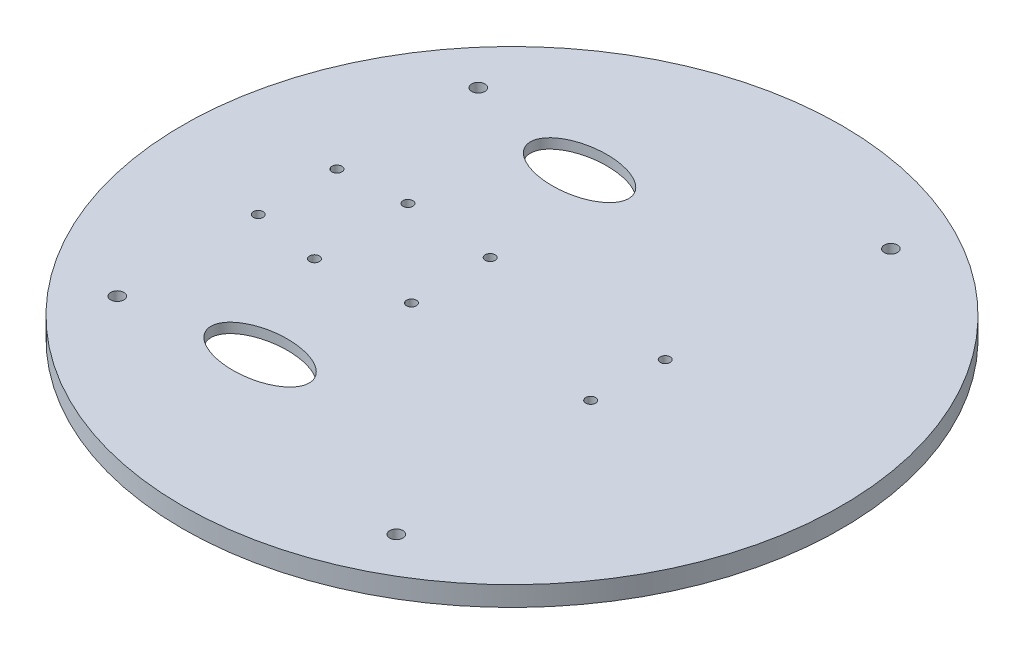
from build123d import *

# Parameters (mm, degrees)
SKETCH_1_R          = 100
EXTRUDE_1_DEPTH     = 3
SKETCH_5_R          = 2
CUT_EXTRUDE_3_DEPTH = 10
SKETCH_6_R          = 1.5
CUT_EXTRUDE_4_DEPTH = 10
SKETCH_7_RX         = 14.914689971
SKETCH_7_RY         = 8.256346234
CUT_EXTRUDE_5_DEPTH = 10
EXTRUDE_START       = 3
SKETCH_9_R          = 100
SKETCH_9_R_2        = 97
EXTRUDE_3_DEPTH     = 3


with BuildPart() as part:
    # Эскиз1 → Бобышка-Вытянуть1 (new body)
    with BuildSketch(Plane(origin=(0, 0, 0), x_dir=(1, 0, 0), z_dir=(0, 1, 0))):
        with Locations(Location((0, 0, 0), (0, 0, 270))):
            Circle(SKETCH_1_R)
    extrude(amount=EXTRUDE_1_DEPTH)

    # Эскиз5 → Вырез-Вытянуть3 (cut)
    with BuildSketch(Plane(origin=(0, 3, 0), x_dir=(1, 0, 0), z_dir=(0, 1, 0))):
        with Locations(Location((39.936936383, -75.033599889, 0), (0, 0, 270))):
            Circle(SKETCH_5_R)
        with Locations(Location((39.936936383, 75.033599889, 0), (0, 0, 270))):
            Circle(SKETCH_5_R)
        with Locations(Location((-65, 54.772255751, 0), (0, 0, 270))):
            Circle(SKETCH_5_R)
        with Locations(Location((-65, -54.772255751, 0), (0, 0, 270))):
            Circle(SKETCH_5_R)
    extrude(amount=-CUT_EXTRUDE_3_DEPTH, mode=Mode.SUBTRACT)

    # Эскиз6 → Вырез-Вытянуть4 (cut)
    with BuildSketch(Plane(origin=(0, 3, 0), x_dir=(1, 0, 0), z_dir=(0, 1, 0))):
        with Locations(Location((-65.064398668, 11.94, 0), (0, 0, 270))):
            Circle(SKETCH_6_R)
        with Locations(Location((-18.564398668, 11.94, 0), (0, 0, 270))):
            Circle(SKETCH_6_R)
        with Locations(Location((-18.564398668, -11.94, 0), (0, 0, 270))):
            Circle(SKETCH_6_R)
        with Locations(Location((-65.064398668, -11.94, 0), (0, 0, 270))):
            Circle(SKETCH_6_R)
        with Locations(Location((34.209802243, -10.340313566, 0), (0, 0, 270))):
            Circle(SKETCH_6_R)
        with Locations(Location((34.82871581, 11.665691446, 0), (0, 0, 270))):
            Circle(SKETCH_6_R)
        with Locations(Location((-45.249923126, 13.677319461, 0), (0, 0, 270))):
            Circle(SKETCH_6_R)
        with Locations(Location((-44.893210092, -15.036739793, 0), (0, 0, 270))):
            Circle(SKETCH_6_R)
    extrude(amount=-CUT_EXTRUDE_4_DEPTH, mode=Mode.SUBTRACT)

    # Эскиз7 → Вырез-Вытянуть5 (cut)
    with BuildSketch(Plane(origin=(0, 3, 0), x_dir=(1, 0, 0), z_dir=(0, 1, 0))):
        with Locations((-27.965043695, 48.472742405)):
            Ellipse(SKETCH_7_RX, SKETCH_7_RY)
        with Locations((-27.965043695, -48.472742405)):
            Ellipse(SKETCH_7_RX, SKETCH_7_RY)
    extrude(amount=-CUT_EXTRUDE_5_DEPTH, mode=Mode.SUBTRACT)

    # Эскиз9 → Бобышка-Вытянуть3 (add)
    with BuildSketch(Plane.XZ.offset(EXTRUDE_START)):
        with Locations(Location((0, 0, 0), (0, 0, 270))):
            Circle(SKETCH_9_R)
        with Locations(Location((0, 0, 0), (0, 0, 270))):
            Circle(SKETCH_9_R_2, mode=Mode.SUBTRACT)
    extrude(amount=-EXTRUDE_3_DEPTH)


solid = part.part
